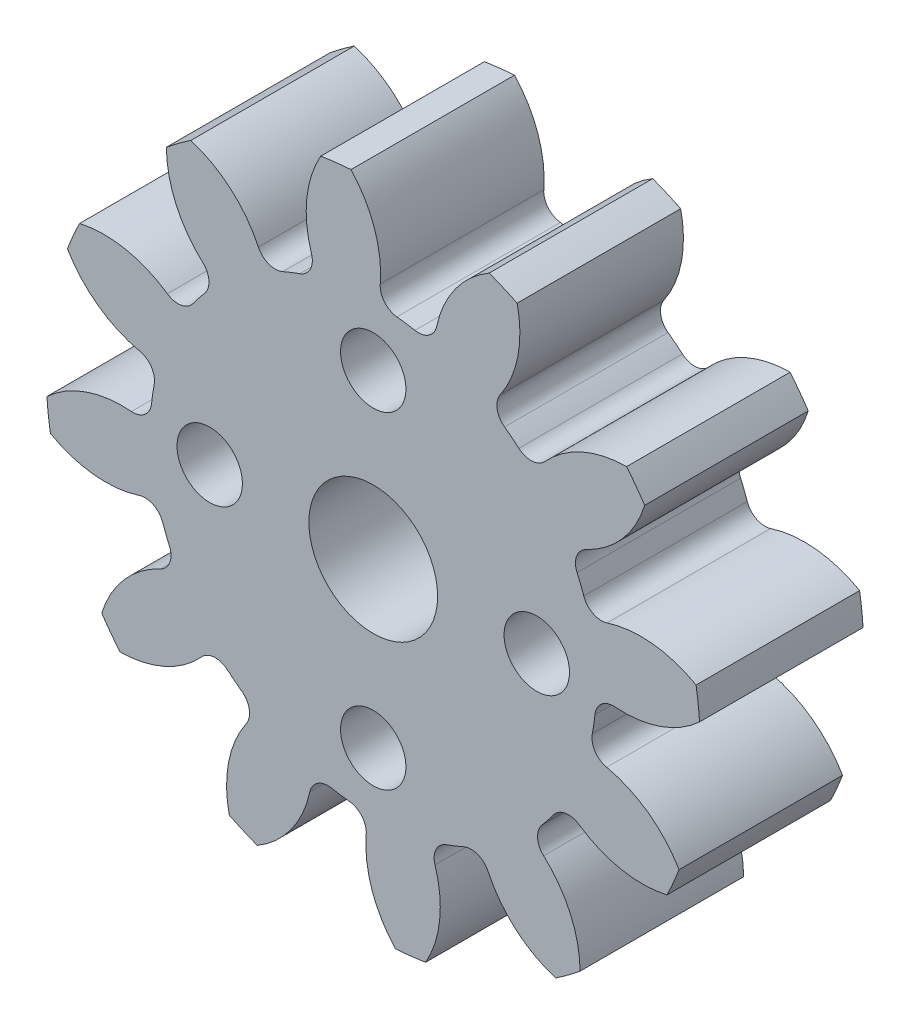
from build123d import *

# Parameters (mm, degrees)
SKETCH3_R         = 12.7
GEARBODY_DEPTH    = 6.35
TOOTHCUT_DEPTH    = 20.05
CIRPATTERN1_COUNT = 12
BOREDIA_R         = 2.5
BOREDIA_R_2       = 1.27
BORE_DEPTH        = 12700


with BuildPart() as part:
    # Sketch3 → gearBody (new body)
    with BuildSketch(Plane.XY):
        Circle(SKETCH3_R)
    extrude(amount=GEARBODY_DEPTH)

    # Sketch2 → toothCut (cut, through all)
    with BuildSketch(Plane.XY):
        with BuildLine():
            ThreePointArc((8.504981128, -1.619352377), (8.564111751, -1.270037802), (8.608901587, -0.918596522))
            ThreePointArc((8.608901587, -0.918596522), (8.867488023, -0.436790342), (9.388953743, -0.272237485))
            ThreePointArc((9.388953743, -0.272237485), (11.599176183, 0.135890641), (13.30511426, 1.599252209))
            ThreePointArc((13.30511426, 1.599252209), (13.255912686, -1.96582094), (12.268366453, -5.391739765))
            ThreePointArc((12.268366453, -5.391739765), (11.060534793, -3.49627294), (9.063879737, -2.464274691))
            ThreePointArc((9.063879737, -2.464274691), (8.61261217, -2.155467755), (8.504981128, -1.619352377))
        make_face()
    toothcut = extrude(amount=TOOTHCUT_DEPTH, mode=Mode.SUBTRACT)

    # CirPattern1: toothCut ×12 about axis
    cirpattern1_axis = Axis((0, 0, 6.35), (0, 0, -1))
    for i in range(1, CIRPATTERN1_COUNT):
        add(toothcut.rotate(cirpattern1_axis, i * 360 / CIRPATTERN1_COUNT), mode=Mode.SUBTRACT)

    # boreDia → bore (cut, symmetric)
    with BuildSketch(Plane.XY):
        Circle(BOREDIA_R)
        with Locations((0, 6.35)):
            Circle(BOREDIA_R_2)
        with Locations((6.35, 0)):
            Circle(BOREDIA_R_2)
        with Locations((-6.35, 0)):
            Circle(BOREDIA_R_2)
        with Locations((0, -6.35)):
            Circle(BOREDIA_R_2)
    extrude(amount=BORE_DEPTH, both=True, mode=Mode.SUBTRACT)


solid = part.part
